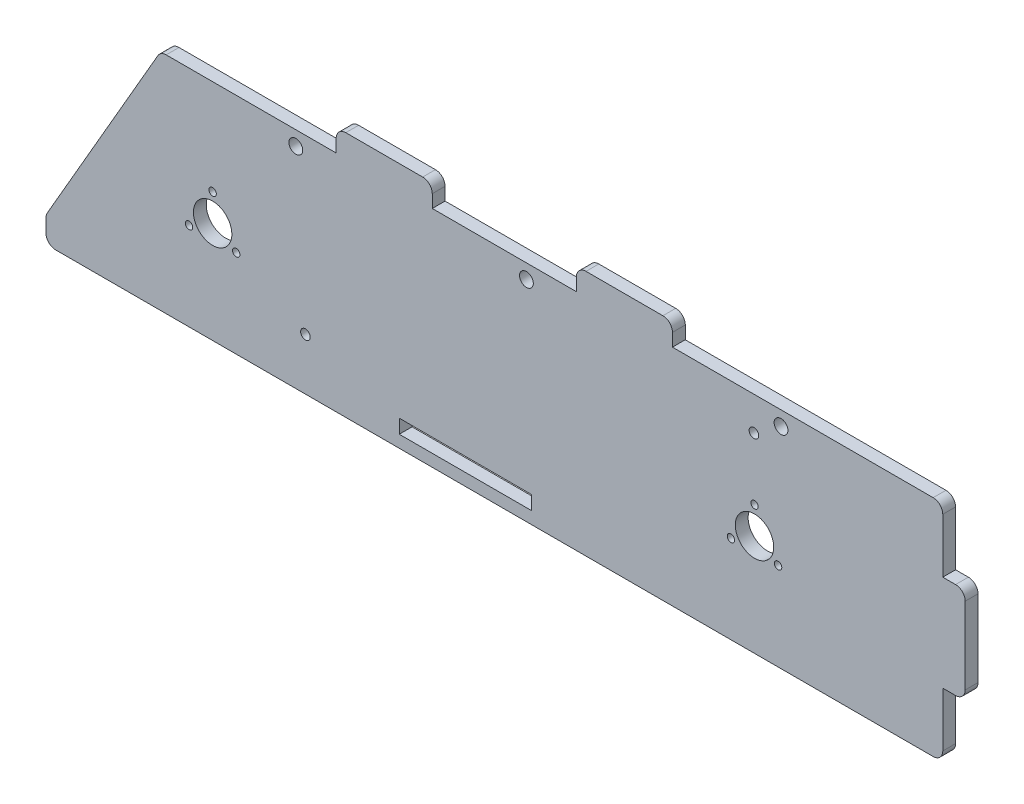
from build123d import *

# Parameters (mm, degrees)
SKETCH1_R           = 6
SKETCH1_R_2         = 1.15
SKETCH1_R_3         = 1.5
SKETCH1_R_4         = 2.15
SKETCH1_W           = 41.3
SKETCH1_H           = 4.35
BOSS_EXTRUDE1_DEPTH = 4
FILLET1_R           = 3


with BuildPart() as part:
    # Sketch1 → Boss-Extrude1 (new body)
    with BuildSketch(Plane.XY):
        Polygon((-128.17175976, -30), (151.82824024, -30), (151.82824024, -10), (158.82824024, -10), (158.82824024, 5), (158.82824024, 20), (151.82824024, 20), (151.82824024, 40), (67.43395693, 40), (67.43395693, 47), (37.43395693, 47), (37.43395693, 40), (-7.56604307, 40), (-7.56604307, 47), (-37.56604307, 47), (-37.56604307, 40), (-92.37604307, 40), (-128.17175976, -22), align=None)
        with Locations((-76.140953501, 1.72)):
            Circle(SKETCH1_R, mode=Mode.SUBTRACT)
        with Locations((-76.140953501, 10.22)):
            Circle(SKETCH1_R_2, mode=Mode.SUBTRACT)
        with Locations((-68.779737569, -2.53)):
            Circle(SKETCH1_R_2, mode=Mode.SUBTRACT)
        with Locations((-83.502169433, -2.53)):
            Circle(SKETCH1_R_2, mode=Mode.SUBTRACT)
        with Locations((93.04824024, 1.72)):
            Circle(SKETCH1_R, mode=Mode.SUBTRACT)
        with Locations((93.04824024, 10.22)):
            Circle(SKETCH1_R_2, mode=Mode.SUBTRACT)
        with Locations((100.409456172, -2.53)):
            Circle(SKETCH1_R_2, mode=Mode.SUBTRACT)
        with Locations((85.687024308, -2.53)):
            Circle(SKETCH1_R_2, mode=Mode.SUBTRACT)
        with Locations((92.86036, 29.5)):
            Circle(SKETCH1_R_3, mode=Mode.SUBTRACT)
        with Locations((-50.17175976, 35.5)):
            Circle(SKETCH1_R_4, mode=Mode.SUBTRACT)
        with Locations((21.82824024, 35.5)):
            Circle(SKETCH1_R_4, mode=Mode.SUBTRACT)
        with Locations((101.32824024, 35.5)):
            Circle(SKETCH1_R_4, mode=Mode.SUBTRACT)
        with Locations((-47.17175976, -13.85)):
            Circle(SKETCH1_R_3, mode=Mode.SUBTRACT)
        with Locations((2.77824024, -24.025)):
            Rectangle(SKETCH1_W, SKETCH1_H, mode=Mode.SUBTRACT)
    extrude(amount=BOSS_EXTRUDE1_DEPTH)

    # Fillet1
    fillet1_edges = [part.edges().sort_by_distance(p)[0] for p in [
        (-128.17175976, -22, 2),
        (-92.37604307, 40, 2),
        (-37.56604307, 47, 2),
        (-7.56604307, 47, 2),
        (37.43395693, 47, 2),
        (67.43395693, 47, 2),
        (151.82824024, 40, 2),
        (158.82824024, 20, 2),
        (158.82824024, -10, 2),
        (151.82824024, -30, 2),
        (-128.17175976, -30, 2),
    ]]
    fillet(fillet1_edges, radius=FILLET1_R)


solid = part.part
